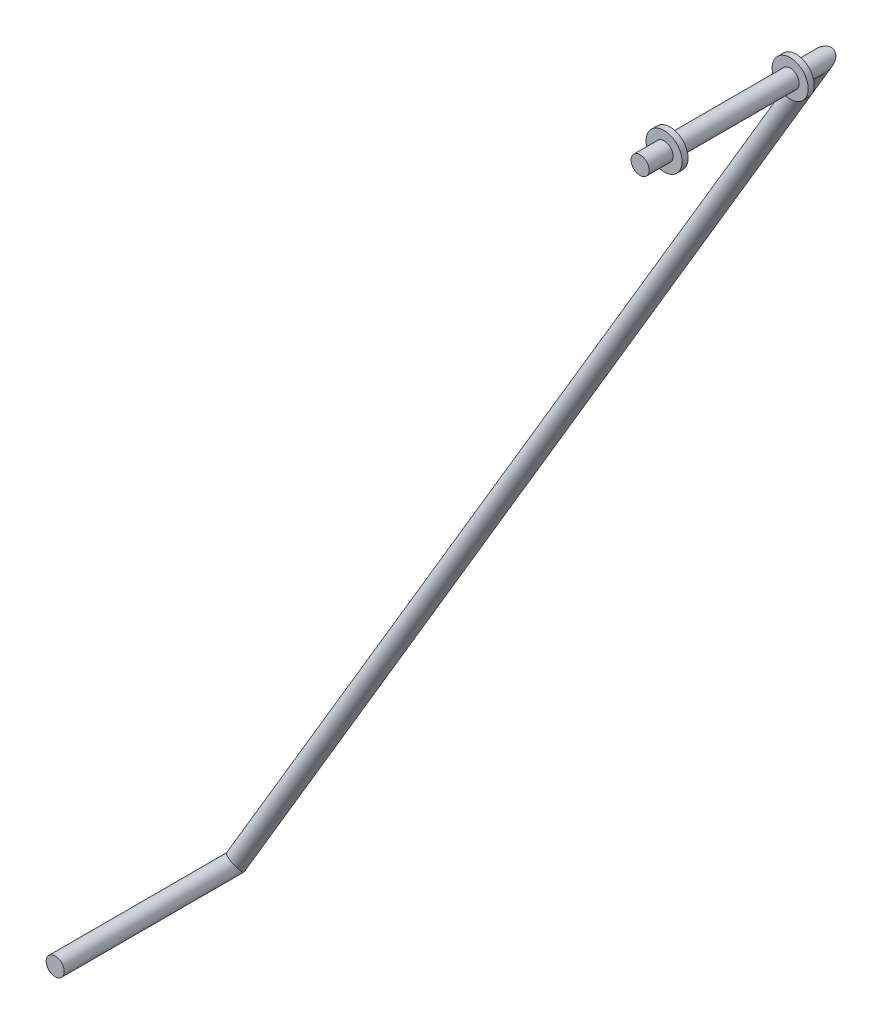
from build123d import *

# Parameters (mm, degrees)
ESQUISSE4_R = 1.5
ESQUISSE5_W = 1.5
ESQUISSE5_H = 1


with BuildPart() as part:
    # Balayage1: sweep along a path in Esquisse3
    with BuildLine(Plane(origin=(0, 0, 0), x_dir=(-0.5100376925115994, -0.8601520518009844, 0), z_dir=(0.8601520518009843, -0.5100376925115992, 0))) as balayage1_path:
        Line((0, -15), (0, 15))
        Line((0, 15), (191.00019974, 15))
        Line((191.00019974, 15), (191.00019974, -15))
    # Esquisse4 → Balayage1 (sweep)
    with BuildSketch(Plane(origin=(0, 0, 15), x_dir=(-1, 0, 0), z_dir=(0, 0, -1))):
        Circle(ESQUISSE4_R)
    sweep(path=balayage1_path.line, transition=Transition.RIGHT)

    # Esquisse5 → Révolution1 (revolve)
    with BuildSketch(Plane(origin=(0, 0, 0), x_dir=(-0.5100376925115994, -0.8601520518009844, 0), z_dir=(0.8601520518009843, -0.5100376925115992, 0)), mode=Mode.PRIVATE) as r_volution1_sk:
        with Locations((-2.25, -10.5)):
            Rectangle(ESQUISSE5_W, ESQUISSE5_H)
        with Locations((-2.25, 10.5)):
            Rectangle(ESQUISSE5_W, ESQUISSE5_H)
    revolve(r_volution1_sk.sketch.rotate(Axis((0, 0, -11), (0, 0, 1)), 30.666340454), axis=Axis((0, 0, -11), (0, 0, 1)))


solid = part.part
